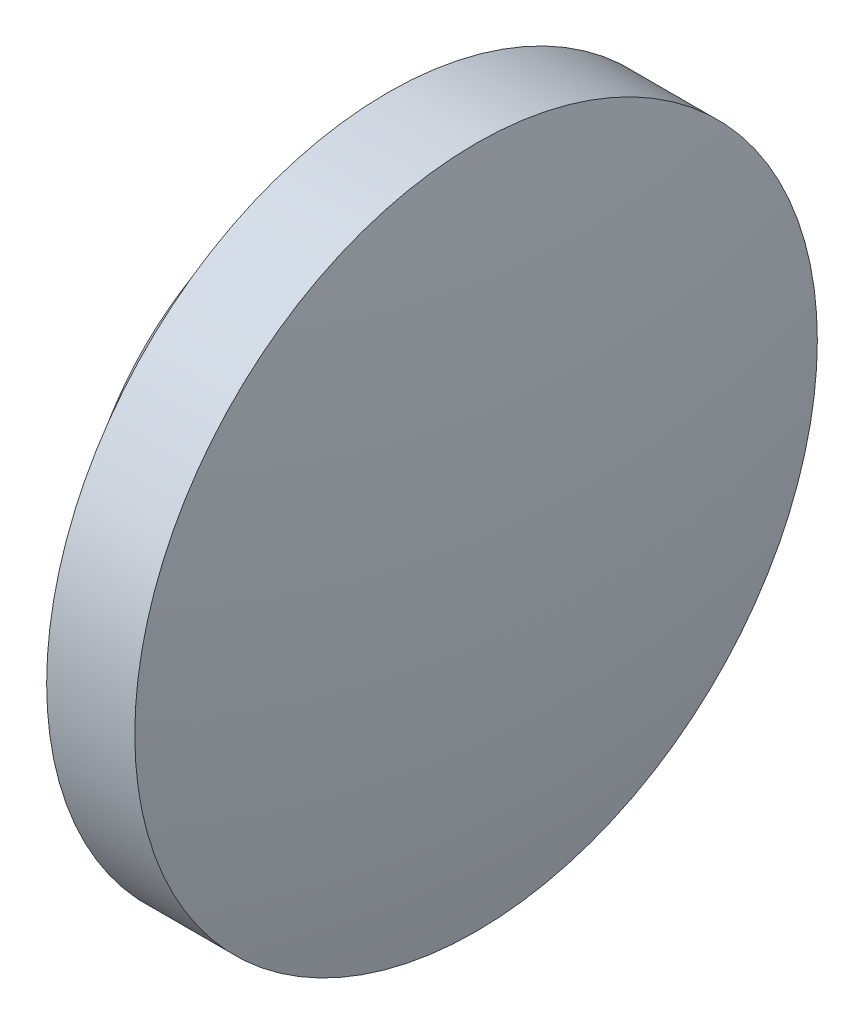
from build123d import *


with BuildPart() as part:
    # Sketch1 → Revolve1 (revolve)
    with BuildSketch(Plane.XY):
        with BuildLine():
            Line((-2.655, 7.5), (-0.718561141, 7.5))
            ThreePointArc((-0.718561141, 7.5), (-0.180050643, 3.767171688), (0, 0))
            Line((0, 0), (-6.38, 0))
            add(Edge.make_bspline(
                [(-2.655, 7.5), (-3.004144627, 6.993475019), (-3.607326921, 6.161097428), (-4.460404437, 5.015634902), (-5.128436689, 4.026528927), (-5.683236496, 3.02986636), (-6.208342702, 1.711140707), (-6.383019912, 0.678682655), (-6.38, 0)],
                knots=[0, 0, 0, 0, 0.216367397, 0.361524104, 0.502322174, 0.635900791, 0.761913849, 1, 1, 1, 1], degree=3))
        make_face()
    revolve(axis=Axis((0, 0, 0), (-1, 0, 0)))


solid = part.part
